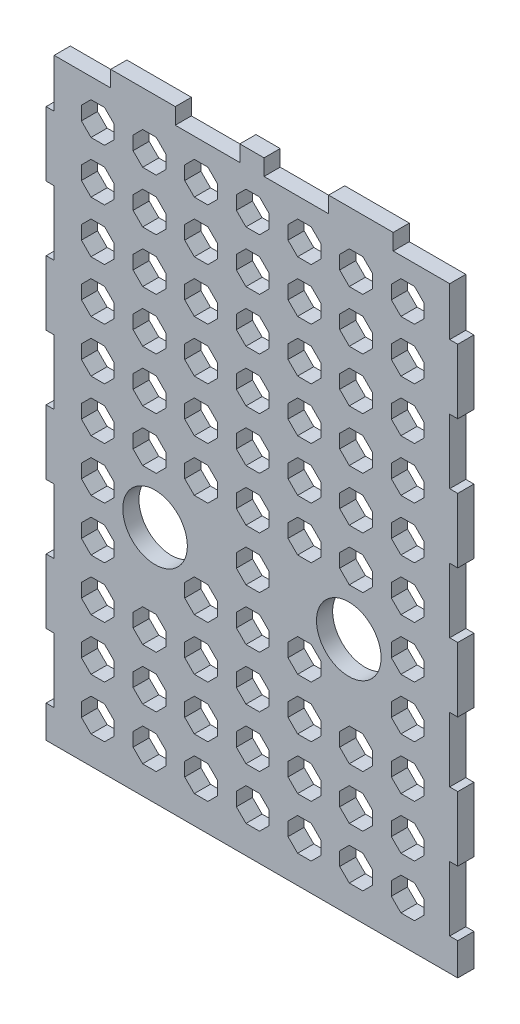
from build123d import *

# Parameters (mm, degrees)
SKETCH1_W               = 80.9625
SKETCH1_H               = 120.65
BOSS_EXTRUDE1_DEPTH     = 3.175
SKETCH2_W               = 1.5875
SKETCH2_H               = 12.7
CUT_EXTRUDE1_DEPTH      = 146.332135233
LPATTERN1_COUNT         = 5
LPATTERN1_PITCH         = 25.4
SKETCH5_W               = 12.7
SKETCH5_H               = 3.175
CUT_EXTRUDE2_DEPTH      = 146.332135233
LPATTERN2_COUNT         = 2
LPATTERN2_PITCH         = 25.4
HOLE1_D                 = 12.7
HOLE1_DEPTH             = 93.98
MIRROR1_COPY_1_SKETCH_W = 1.5875
MIRROR1_COPY_1_SKETCH_H = 12.7
MIRROR1_COPY_1_DEPTH    = 146.332135233
MIRROR1_COPY_2_SKETCH_W = 1.5875
MIRROR1_COPY_2_SKETCH_H = 12.7
MIRROR1_COPY_2_DEPTH    = 146.332135233
MIRROR1_COPY_3_SKETCH_W = 1.5875
MIRROR1_COPY_3_SKETCH_H = 12.7
MIRROR1_COPY_3_DEPTH    = 146.332135233
MIRROR1_COPY_4_SKETCH_W = 1.5875
MIRROR1_COPY_4_SKETCH_H = 12.7
MIRROR1_COPY_4_DEPTH    = 146.332135233
MIRROR1_COPY_5_SKETCH_W = 12.7
MIRROR1_COPY_5_SKETCH_H = 3.175
MIRROR1_COPY_5_DEPTH    = 146.332135233
CUT_EXTRUDE3_DEPTH      = 146.332135233
LPATTERN6_COUNT         = 7
LPATTERN6_PITCH         = 10.16
LPATTERN6_COUNT_DIR2    = 11
LPATTERN6_PITCH_DIR2    = 10.16


with BuildPart() as part:
    # Sketch1 → Boss-Extrude1 (new body)
    with BuildSketch(Plane.XY):
        with Locations((40.48125, -60.325)):
            Rectangle(SKETCH1_W, SKETCH1_H)
    extrude(amount=BOSS_EXTRUDE1_DEPTH)

    # Sketch2 → Cut-Extrude1 (cut, through all)
    with BuildSketch(Plane.XY.offset(3.175)):
        with Locations((0.79375, -6.35)):
            Rectangle(SKETCH2_W, SKETCH2_H)
    cut_extrude1 = extrude(amount=-CUT_EXTRUDE1_DEPTH, mode=Mode.SUBTRACT)

    # LPattern1: Cut-Extrude1 ×5
    with Locations(*[(0, -i * LPATTERN1_PITCH, 0) for i in range(1, LPATTERN1_COUNT)]):
        add(cut_extrude1, mode=Mode.SUBTRACT)

    # Sketch5 → Cut-Extrude2 (cut, through all)
    with BuildSketch(Plane.XY.offset(3.175)):
        with Locations((6.35, -1.5875)):
            Rectangle(SKETCH5_W, SKETCH5_H)
    cut_extrude2 = extrude(amount=-CUT_EXTRUDE2_DEPTH, mode=Mode.SUBTRACT)

    # LPattern2: Cut-Extrude2 ×2
    with Locations(*[(i * LPATTERN2_PITCH, 0, 0) for i in range(1, LPATTERN2_COUNT)]):
        add(cut_extrude2, mode=Mode.SUBTRACT)

    # Hole1
    with Locations(Plane.XY.offset(3.175)):
        with Locations((21.43125, -73.66)):
            hole1 = Hole(HOLE1_D / 2, depth=HOLE1_DEPTH)

    # Mirror1: Cut-Extrude1, Cut-Extrude2, Hole1 across plane
    add(cut_extrude1.mirror(Plane(origin=(40.48125, 0, 0), x_dir=(0, 0, 1), z_dir=(1, 0, 0))), mode=Mode.SUBTRACT)
    add(cut_extrude2.mirror(Plane(origin=(40.48125, 0, 0), x_dir=(0, 0, 1), z_dir=(1, 0, 0))), mode=Mode.SUBTRACT)
    add(hole1.mirror(Plane(origin=(40.48125, 0, 0), x_dir=(0, 0, 1), z_dir=(1, 0, 0))), mode=Mode.SUBTRACT)

    # Mirror1 copy 1 sketch → Mirror1 copy 1 (cut, through all)
    with BuildSketch(Plane(origin=(80.9625, -25.4, 3.175), x_dir=(-1, 0, 0), z_dir=(0, 0, 1))):
        with Locations((0.79375, 6.35)):
            Rectangle(MIRROR1_COPY_1_SKETCH_W, MIRROR1_COPY_1_SKETCH_H)
    extrude(amount=-MIRROR1_COPY_1_DEPTH, mode=Mode.SUBTRACT)

    # Mirror1 copy 2 sketch → Mirror1 copy 2 (cut, through all)
    with BuildSketch(Plane(origin=(80.9625, -50.8, 3.175), x_dir=(-1, 0, 0), z_dir=(0, 0, 1))):
        with Locations((0.79375, 6.35)):
            Rectangle(MIRROR1_COPY_2_SKETCH_W, MIRROR1_COPY_2_SKETCH_H)
    extrude(amount=-MIRROR1_COPY_2_DEPTH, mode=Mode.SUBTRACT)

    # Mirror1 copy 3 sketch → Mirror1 copy 3 (cut, through all)
    with BuildSketch(Plane(origin=(80.9625, -76.2, 3.175), x_dir=(-1, 0, 0), z_dir=(0, 0, 1))):
        with Locations((0.79375, 6.35)):
            Rectangle(MIRROR1_COPY_3_SKETCH_W, MIRROR1_COPY_3_SKETCH_H)
    extrude(amount=-MIRROR1_COPY_3_DEPTH, mode=Mode.SUBTRACT)

    # Mirror1 copy 4 sketch → Mirror1 copy 4 (cut, through all)
    with BuildSketch(Plane(origin=(80.9625, -101.6, 3.175), x_dir=(-1, 0, 0), z_dir=(0, 0, 1))):
        with Locations((0.79375, 6.35)):
            Rectangle(MIRROR1_COPY_4_SKETCH_W, MIRROR1_COPY_4_SKETCH_H)
    extrude(amount=-MIRROR1_COPY_4_DEPTH, mode=Mode.SUBTRACT)

    # Mirror1 copy 5 sketch → Mirror1 copy 5 (cut, through all)
    with BuildSketch(Plane(origin=(55.5625, 0, 3.175), x_dir=(-1, 0, 0), z_dir=(0, 0, 1))):
        with Locations((6.35, 1.5875)):
            Rectangle(MIRROR1_COPY_5_SKETCH_W, MIRROR1_COPY_5_SKETCH_H)
    extrude(amount=-MIRROR1_COPY_5_DEPTH, mode=Mode.SUBTRACT)

    # Sketch10 → Cut-Extrude3 (cut, through all)
    with BuildSketch(Plane.XY.offset(3.175)):
        Polygon((13.379353785, -8.995203569), (11.4935, -7.109349784), (8.8265, -7.109349784), (6.940646215, -8.995203569), (6.940646215, -11.662203569), (8.8265, -13.548057354), (11.4935, -13.548057354), (13.379353785, -11.662203569), align=None)
    cut_extrude3 = extrude(amount=-CUT_EXTRUDE3_DEPTH, mode=Mode.SUBTRACT)

    # LPattern6: Cut-Extrude3 7 × 11, 6 skipped
    with Locations(*[(i * LPATTERN6_PITCH, -j * LPATTERN6_PITCH_DIR2, 0) for i in range(LPATTERN6_COUNT) for j in range(LPATTERN6_COUNT_DIR2) if (i, j) not in ((0, 0), (1, 6), (1, 7), (2, 6), (4, 6), (5, 6), (5, 7))]):
        add(cut_extrude3, mode=Mode.SUBTRACT)


solid = part.part
